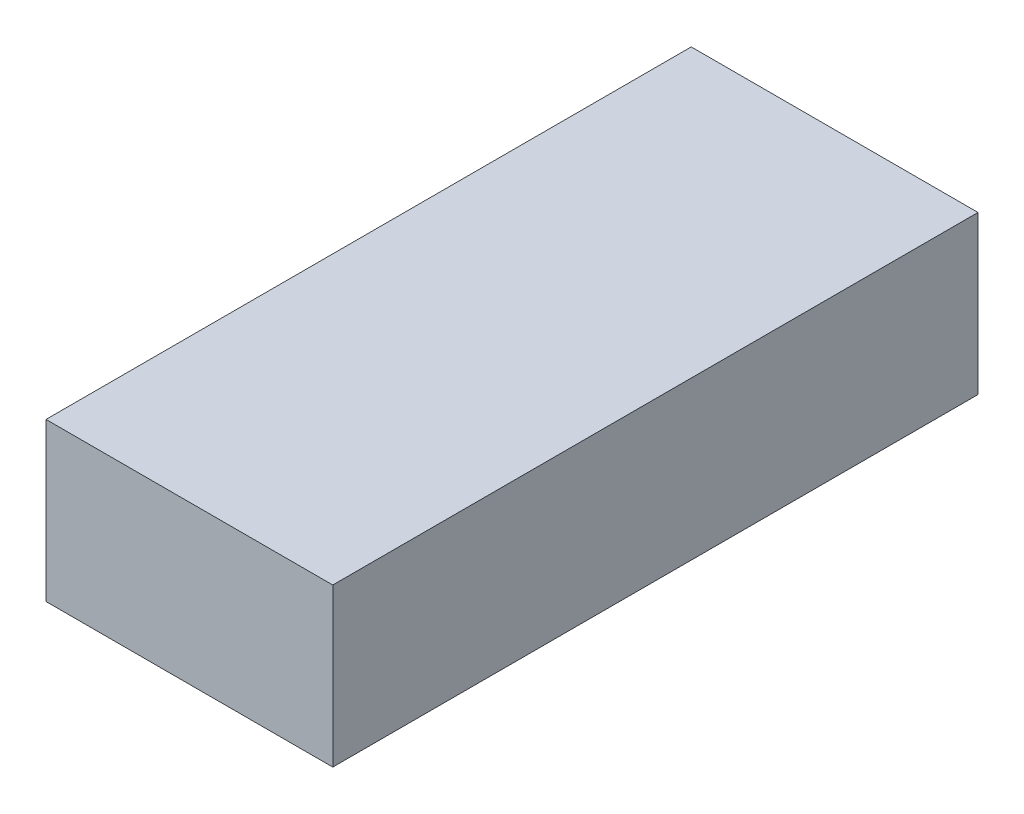
from build123d import *

# Parameters (mm, degrees)
SKETCH1_W           = 20
SKETCH1_H           = 11
BOSS_EXTRUDE1_DEPTH = 45


with BuildPart() as part:
    # Sketch1 → Boss-Extrude1 (new body)
    with BuildSketch(Plane.XY):
        with Locations((10, 5.5)):
            Rectangle(SKETCH1_W, SKETCH1_H)
    extrude(amount=BOSS_EXTRUDE1_DEPTH)


solid = part.part
